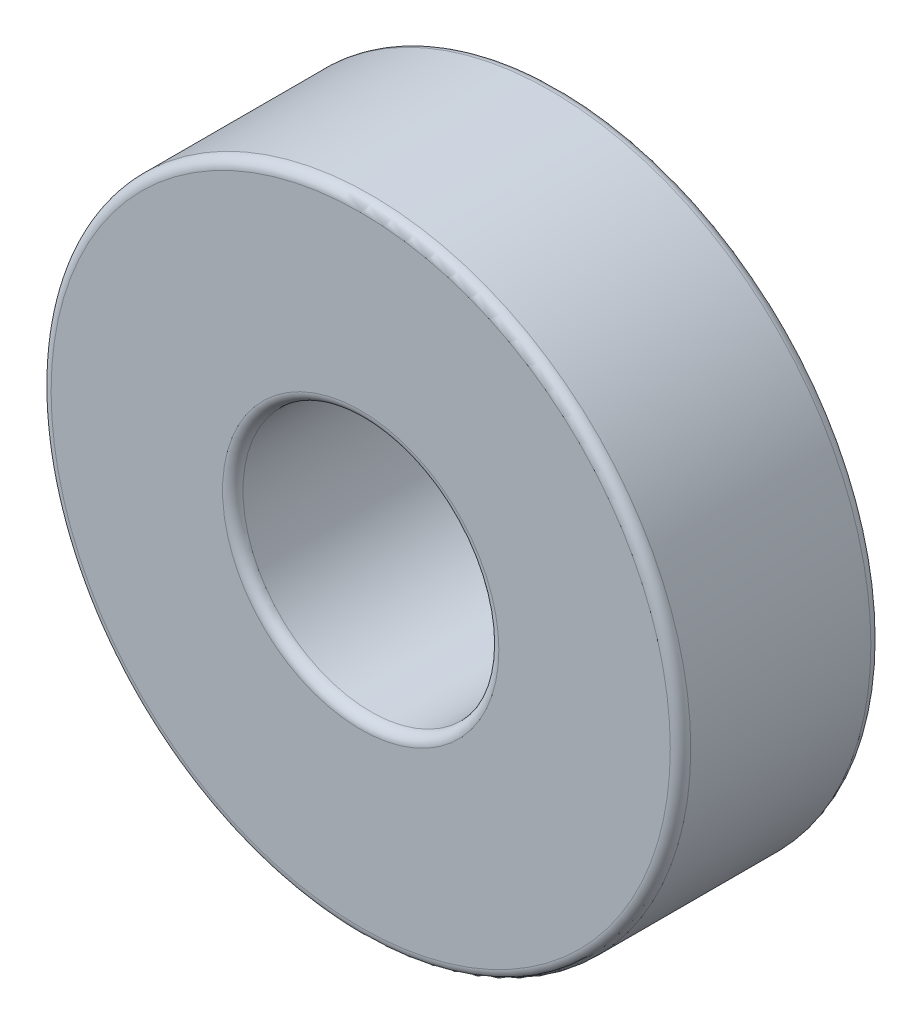
from build123d import *

# Parameters (mm, degrees)
SKETCH1_R               = 7.9375
BOSS_EXTRUDE1_DEPTH     = 4.9784
CUT_EXTRUDE1_DEPTH      = 13.279750774
CUT_EXTRUDE1_DEPTH_BACK = 13.279750774
SKETCH2_R               = 3.175
FILLET1_R               = 0.254
FILLET2_R               = 0.254


with BuildPart() as part:
    # Sketch1 → Boss-Extrude1 (new body)
    with BuildSketch(Plane.XY):
        Circle(SKETCH1_R)
    extrude(amount=-BOSS_EXTRUDE1_DEPTH)

    # Sketch2 → Cut-Extrude1 (cut, two sides: drawn at the far end of the back side and taken through both)
    with BuildSketch(Plane.XY.offset(-CUT_EXTRUDE1_DEPTH_BACK)):
        Circle(SKETCH2_R)
    extrude(amount=CUT_EXTRUDE1_DEPTH + CUT_EXTRUDE1_DEPTH_BACK, mode=Mode.SUBTRACT)

    # Fillet1
    fillet1_edges = [part.edges().sort_by_distance(p)[0] for p in [
        (-7.9375, 0, 0),
    ]]
    fillet(fillet1_edges, radius=FILLET1_R)

    # Fillet2
    fillet2_edges = [part.edges().sort_by_distance(p)[0] for p in [
        (-7.9375, 0, -4.9784),
        (-3.175, 0, 0),
        (-3.175, 0, -4.9784),
    ]]
    fillet(fillet2_edges, radius=FILLET2_R)


solid = part.part
